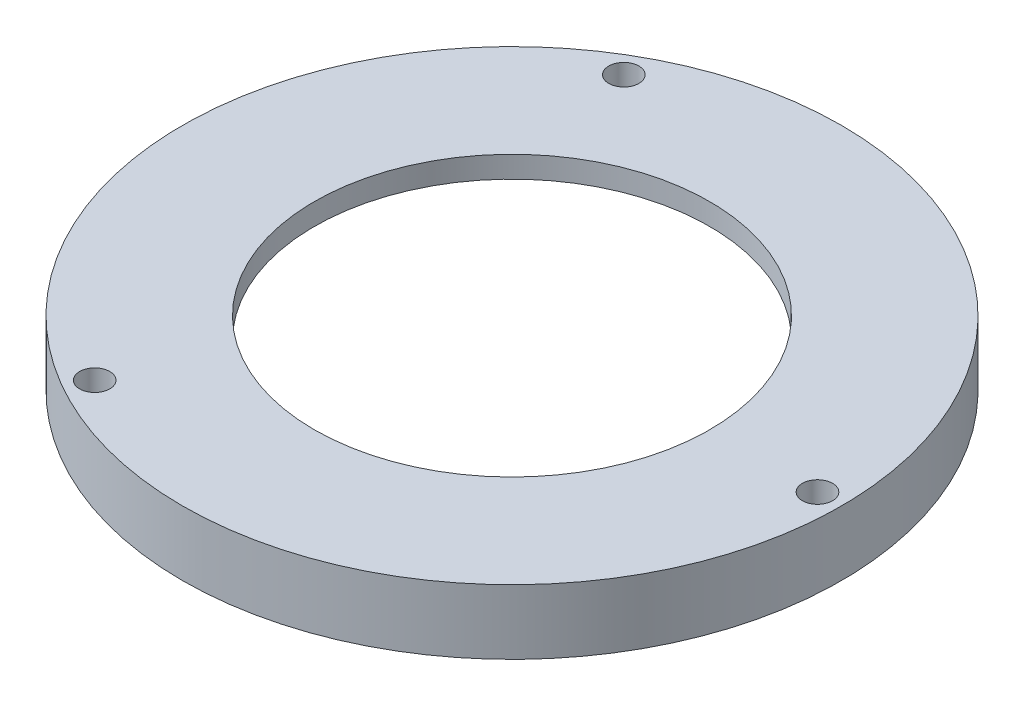
from build123d import *

# Parameters (mm, degrees)
SKETCH1_R           = 45.85
SKETCH1_R_2         = 2.1
SKETCH1_R_3         = 39.3
BOSS_EXTRUDE1_DEPTH = 6
BOSS_EXTRUDE2_START = 3
SKETCH1_4_R         = 45.85
SKETCH1_4_R_2       = 2.1
SKETCH1_4_R_3       = 27.5
BOSS_EXTRUDE2_DEPTH = 3


with BuildPart() as part:
    # Sketch1 → Boss-Extrude1 (new body)
    with BuildSketch(Plane(origin=(0, 0, 0), x_dir=(1, 0, 0), z_dir=(0, 1, 0))):
        Circle(SKETCH1_R)
        with Locations((-21.25, -36.806079661)):
            Circle(SKETCH1_R_2, mode=Mode.SUBTRACT)
        with Locations((-21.25, 36.806079661)):
            Circle(SKETCH1_R_2, mode=Mode.SUBTRACT)
        Circle(SKETCH1_R_3, mode=Mode.SUBTRACT)
        with Locations((42.5, 0)):
            Circle(SKETCH1_R_2, mode=Mode.SUBTRACT)
    extrude(amount=-BOSS_EXTRUDE1_DEPTH)

    # Sketch1<4> → Boss-Extrude2 (add)
    with BuildSketch(Plane(origin=(0, 0, 0), x_dir=(1, 0, 0), z_dir=(0, 1, 0)).offset(BOSS_EXTRUDE2_START)):
        Circle(SKETCH1_4_R)
        with Locations((-21.25, -36.806079661)):
            Circle(SKETCH1_4_R_2, mode=Mode.SUBTRACT)
        with Locations((-21.25, 36.806079661)):
            Circle(SKETCH1_4_R_2, mode=Mode.SUBTRACT)
        with Locations((42.5, 0)):
            Circle(SKETCH1_4_R_2, mode=Mode.SUBTRACT)
        Circle(SKETCH1_4_R_3, mode=Mode.SUBTRACT)
    extrude(amount=-BOSS_EXTRUDE2_DEPTH)


solid = part.part
